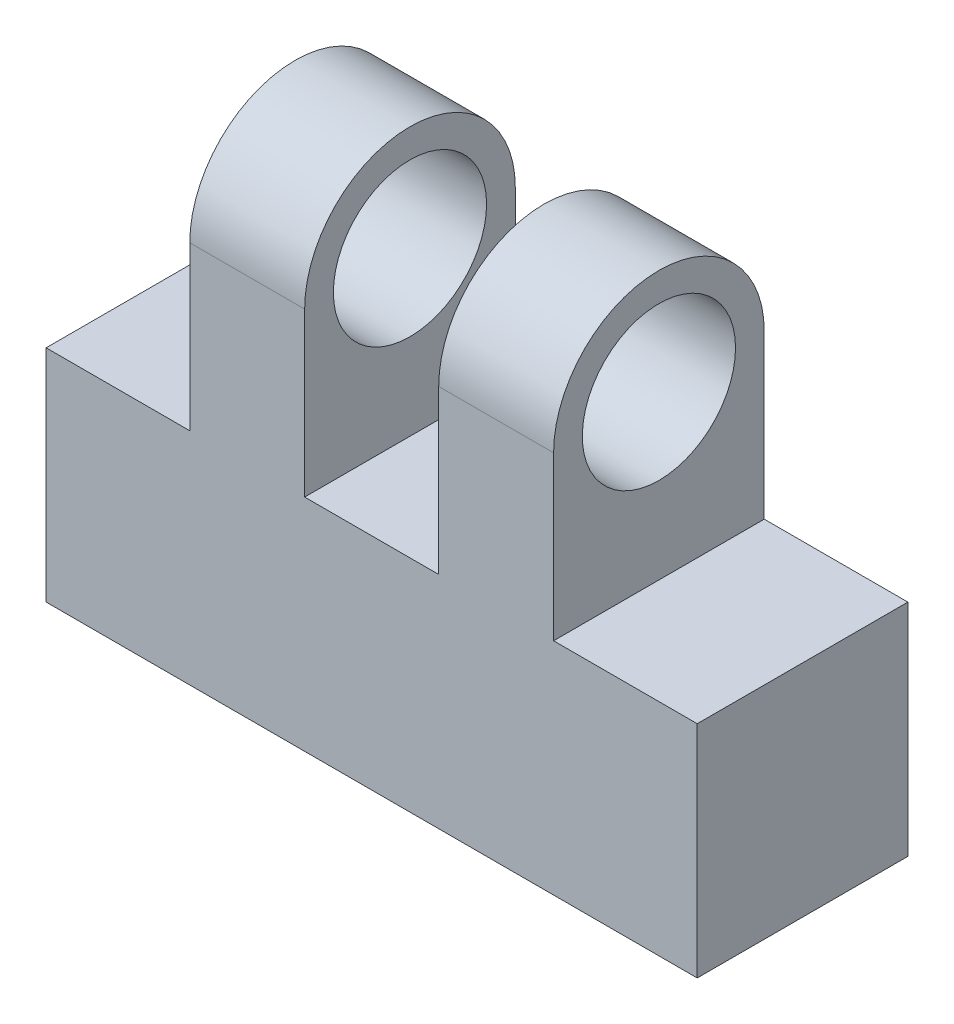
from build123d import *

# Parameters (mm, degrees)
SKETCH_1_R          = 4
EXTRUDE_1_DEPTH     = 34
SKETCH_2_W          = 7.5
SKETCH_2_H          = 14
SKETCH_2_W_2        = 3.5
CUT_EXTRUDE_2_DEPTH = 41.951190459


with BuildPart() as part:
    # 草图1 → 凸台-拉伸1 (new body)
    with BuildSketch(Plane(origin=(0, 0, 0), x_dir=(0, 0, -1), z_dir=(1, 0, 0))):
        with BuildLine():
            Line((-5.5, 0), (-5.5, -20))
            Line((-5.5, -20), (5.5, -20))
            Line((5.5, -20), (5.5, 0))
            ThreePointArc((5.5, 0), (0, 5.5), (-5.5, 0))
        make_face()
        Circle(SKETCH_1_R, mode=Mode.SUBTRACT)
    extrude(amount=EXTRUDE_1_DEPTH)

    # 草图2 → 切除-拉伸2 (cut, through all)
    with BuildSketch(Plane.XY.offset(5.5)):
        with Locations((3.75, -1.5)):
            Rectangle(SKETCH_2_W, SKETCH_2_H)
        with Locations((18.75, -1.5)):
            Rectangle(SKETCH_2_W_2, SKETCH_2_H)
        with Locations((15.25, -1.5)):
            Rectangle(SKETCH_2_W_2, SKETCH_2_H)
        with Locations((30.25, -1.5)):
            Rectangle(SKETCH_2_W, SKETCH_2_H)
    extrude(amount=-CUT_EXTRUDE_2_DEPTH, mode=Mode.SUBTRACT)


solid = part.part
